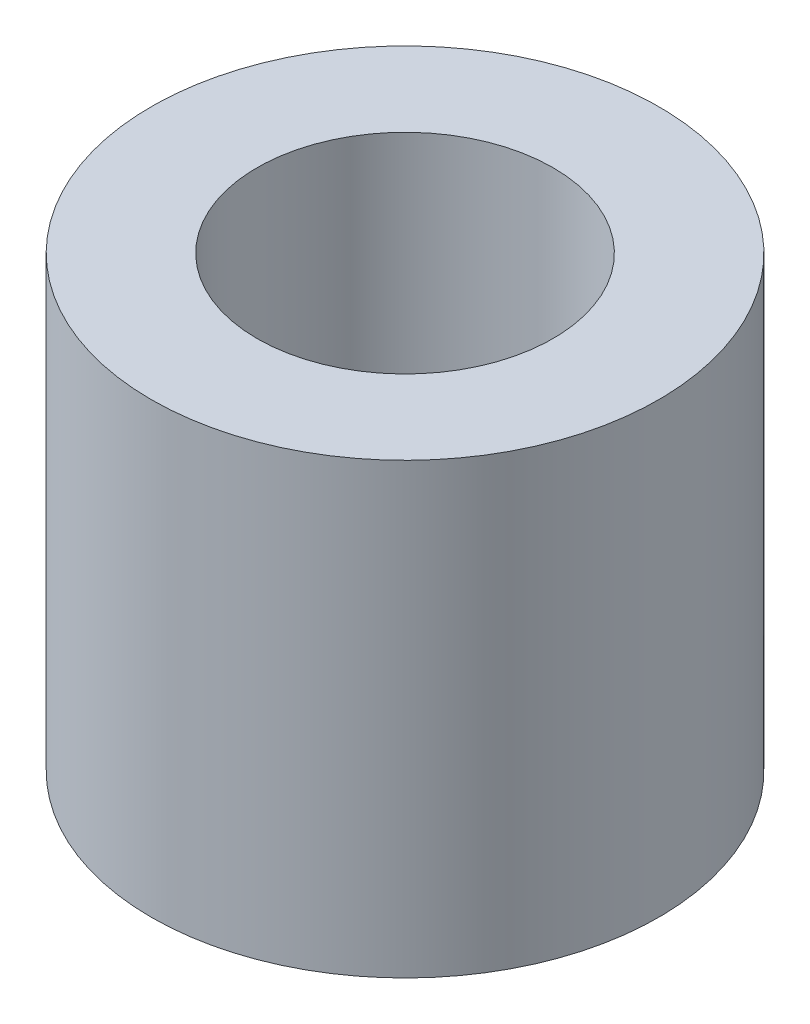
from build123d import *

# Parameters (mm, degrees)
SKETCH_1_R      = 3
SKETCH_1_R_2    = 1.75
EXTRUDE_1_DEPTH = 5.3


with BuildPart() as part:
    # 草图1 → 凸台-拉伸1 (new body)
    with BuildSketch(Plane(origin=(0, 0, 0), x_dir=(1, 0, 0), z_dir=(0, 1, 0))):
        with Locations(Location((0, 0, 0), (0, 0, 270))):
            Circle(SKETCH_1_R)
        with Locations(Location((0, 0, 0), (0, 0, 270))):
            Circle(SKETCH_1_R_2, mode=Mode.SUBTRACT)
    extrude(amount=EXTRUDE_1_DEPTH)


solid = part.part
